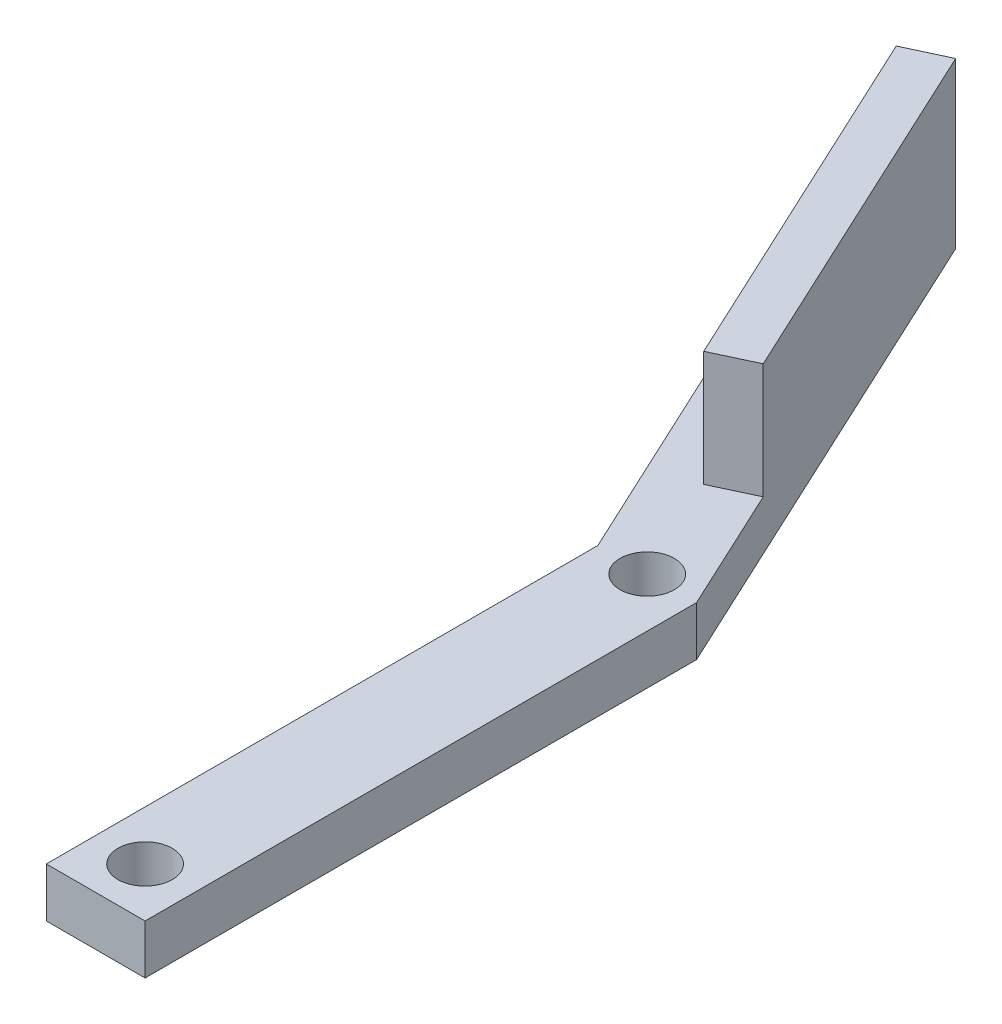
from build123d import *

# Parameters (mm, degrees)
SKETCH1_R           = 1.65
BOSS_EXTRUDE1_DEPTH = 3
BOSS_EXTRUDE2_DEPTH = 10


with BuildPart() as part:
    # Sketch1 → Boss-Extrude1 (new body)
    with BuildSketch(Plane(origin=(0, 0, 0), x_dir=(1, 0, 0), z_dir=(0, 1, 0))):
        Polygon((-3, 30.5), (-3, -3), (3, -3), (3, 30.5), (-0.535818585, 38.082587426), (-3, 36.933520762), (-13.214366438, 58.838300276), (-15.678547852, 57.689233611), align=None)
        with Locations((0, 30.5)):
            Circle(SKETCH1_R, mode=Mode.SUBTRACT)
        Circle(SKETCH1_R, mode=Mode.SUBTRACT)
    extrude(amount=BOSS_EXTRUDE1_DEPTH)

    # Sketch1<4> → Boss-Extrude2 (add)
    with BuildSketch(Plane(origin=(0, 0, 0), x_dir=(1, 0, 0), z_dir=(0, 1, 0))):
        Polygon((-10.750185023, 59.98736694), (-13.214366438, 58.838300276), (-3, 36.933520762), (-0.535818585, 38.082587426), align=None)
    extrude(amount=BOSS_EXTRUDE2_DEPTH)


solid = part.part
